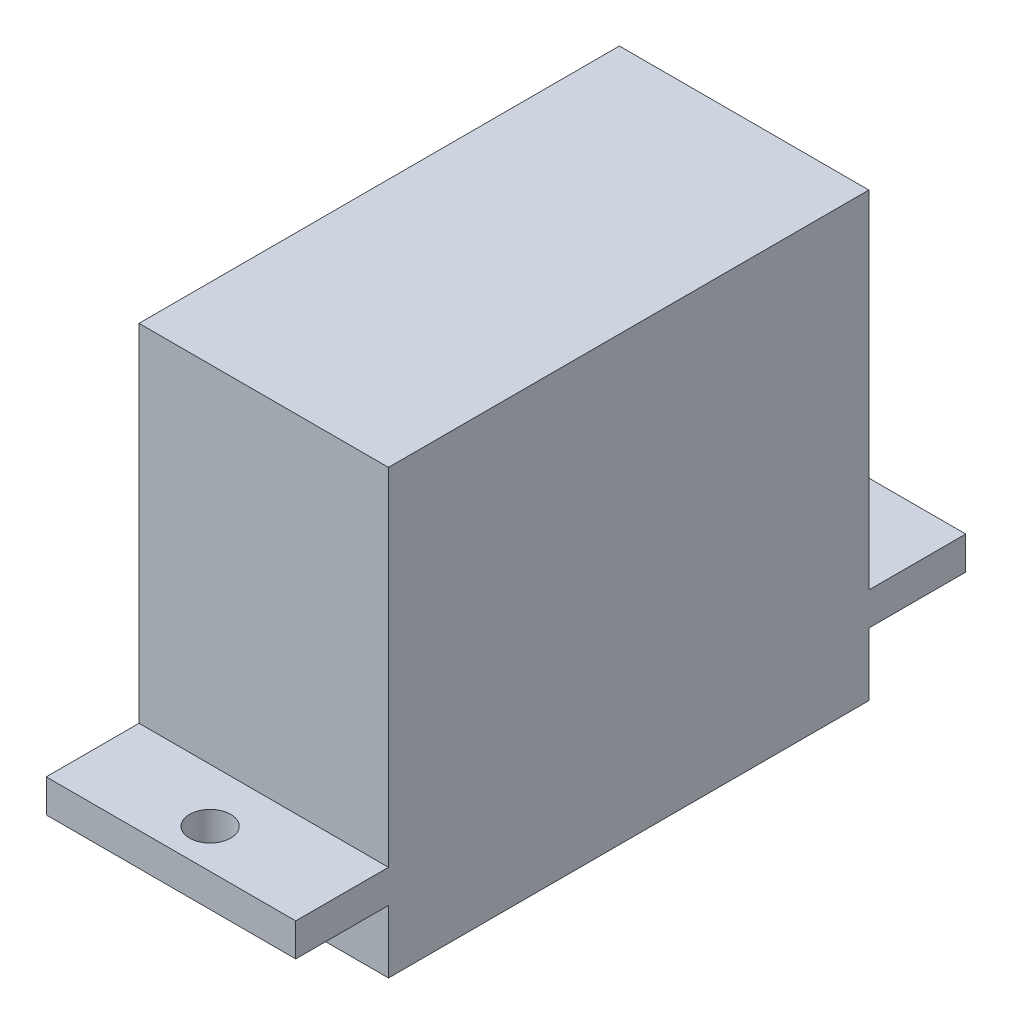
from build123d import *

# Parameters (mm, degrees)
SKETCH_3_W          = 32.5
SKETCH_3_H          = 21.45
EXTRUDE_1_DEPTH     = 6.05
CUT_EXTRUDE_START   = -3.86581
SKETCH_4_W          = 12.1
SKETCH_4_H          = 4.7
SKETCH_4_H_2        = 4.6
CUT_EXTRUDE_1_DEPTH = 26.951221363
CUT_EXTRUDE_START_2 = -5.46581
SKETCH_4_2_W        = 12.1
SKETCH_4_2_H        = 4.7
SKETCH_4_2_H_2      = 4.6
CUT_EXTRUDE_2_DEPTH = 17.619601363
SKETCH_5_R          = 1
CUT_EXTRUDE_3_DEPTH = 23.085411363
SKETCH_7_R          = 1.557821419
SKETCH_7_R_2        = 1.04903278
EXTRUDE_3_DEPTH     = 3


with BuildPart() as part:
    # 草图3 → 凸台-拉伸1 (new, symmetric)
    with BuildSketch(Plane(origin=(0, 0, 0), x_dir=(0, 0, -1), z_dir=(1, 0, 0))):
        with Locations((-0.5985, 2.2091)):
            Rectangle(SKETCH_3_W, SKETCH_3_H)
    extrude(amount=EXTRUDE_1_DEPTH, both=True)

    # 草图4 → 切除-拉伸1 (cut, through all)
    with BuildSketch(Plane(origin=(0, 0, 0), x_dir=(1, 0, 0), z_dir=(0, 1, 0)).offset(CUT_EXTRUDE_START)):
        with Locations((0, 13.30155)):
            Rectangle(SKETCH_4_W, SKETCH_4_H)
        with Locations((0, -14.6484)):
            Rectangle(SKETCH_4_W, SKETCH_4_H_2)
    extrude(amount=CUT_EXTRUDE_1_DEPTH, mode=Mode.SUBTRACT)

    # 草图4<2> → 切除-拉伸2 (cut, through all)
    with BuildSketch(Plane(origin=(0, 0, 0), x_dir=(1, 0, 0), z_dir=(0, 1, 0)).offset(CUT_EXTRUDE_START_2)):
        with Locations((0, 13.30155)):
            Rectangle(SKETCH_4_2_W, SKETCH_4_2_H)
        with Locations((0, -14.6484)):
            Rectangle(SKETCH_4_2_W, SKETCH_4_2_H_2)
    extrude(amount=-CUT_EXTRUDE_2_DEPTH, mode=Mode.SUBTRACT)

    # 草图5 → 切除-拉伸3 (cut, through all)
    with BuildSketch(Plane(origin=(0, 0, 0), x_dir=(1, 0, 0), z_dir=(0, 1, 0))):
        with Locations((0, 13.55)):
            Circle(SKETCH_5_R)
        with Locations((0, -14.949238683)):
            Circle(SKETCH_5_R)
    extrude(amount=-CUT_EXTRUDE_3_DEPTH, mode=Mode.SUBTRACT)

    # 草图7 → 凸台-拉伸3 (add)
    with BuildSketch(Plane.XZ.offset(8.5159)):
        with Locations((0, -7.64347992)):
            Circle(SKETCH_7_R)
        with Locations((0, -7.64347992)):
            Circle(SKETCH_7_R_2, mode=Mode.SUBTRACT)
    extrude(amount=EXTRUDE_3_DEPTH)


solid = part.part
